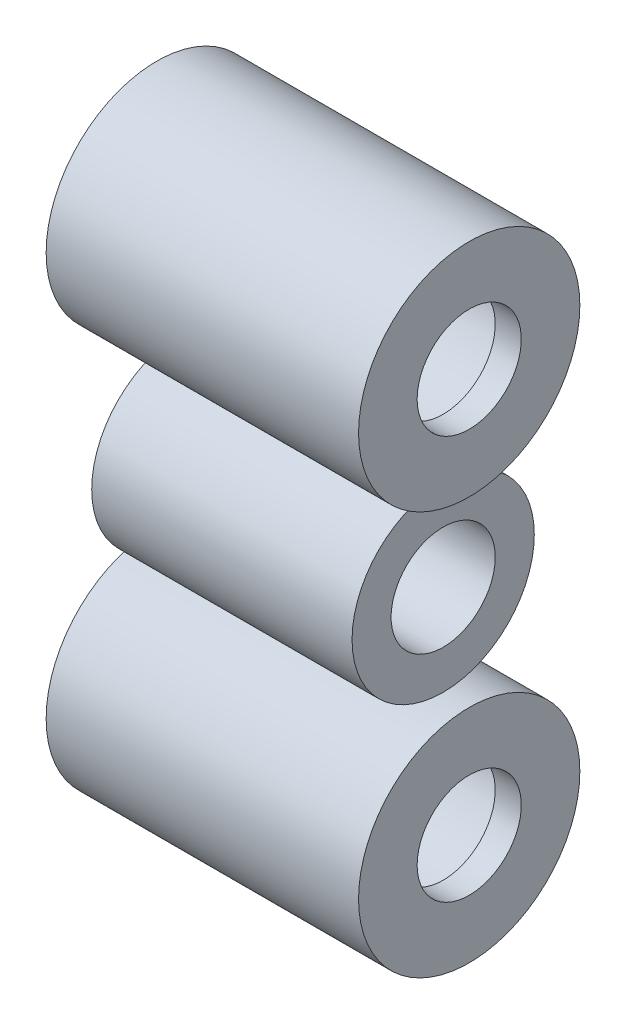
from build123d import *

# Parameters (mm, degrees)
SKETCH1_R           = 7
SKETCH1_R_2         = 4
BOSS_EXTRUDE1_DEPTH = 10


with BuildPart() as part:
    # Sketch1 → Boss-Extrude1 (new, symmetric)
    with BuildSketch(Plane(origin=(0, 0, 0), x_dir=(0, 0, -1), z_dir=(1, 0, 0))):
        Circle(SKETCH1_R)
        Circle(SKETCH1_R_2, mode=Mode.SUBTRACT)
    extrude(amount=BOSS_EXTRUDE1_DEPTH, both=True)


with BuildPart() as body_2:
    # Sketch2 → Revolve1 (revolve)
    with BuildSketch(Plane.XY, mode=Mode.PRIVATE) as revolve1_sk:
        Polygon((-12, 24), (12, 24), (12, 19.5), (10, 19.5), (10, 22), (-10, 22), (-10, 19.5), (-12, 19.5), align=None)
    revolve(revolve1_sk.sketch.rotate(Axis((-16.910318353, 15.5, 0), (1, 0, 0)), 90), axis=Axis((-16.910318353, 15.5, 0), (1, 0, 0)))


with BuildPart() as body_3:
    # Sketch3 → Revolve2 (revolve)
    with BuildSketch(Plane.XY, mode=Mode.PRIVATE) as revolve2_sk:
        Polygon((-12, -24), (12, -24), (12, -19.5), (10, -19.5), (10, -22), (-10, -22), (-10, -19.5), (-12, -19.5), align=None)
    revolve(revolve2_sk.sketch.rotate(Axis((-16.910318353, -15.5, 0), (1, 0, 0)), 270), axis=Axis((-16.910318353, -15.5, 0), (1, 0, 0)))


solid = Compound([part.part, body_2.part, body_3.part])
